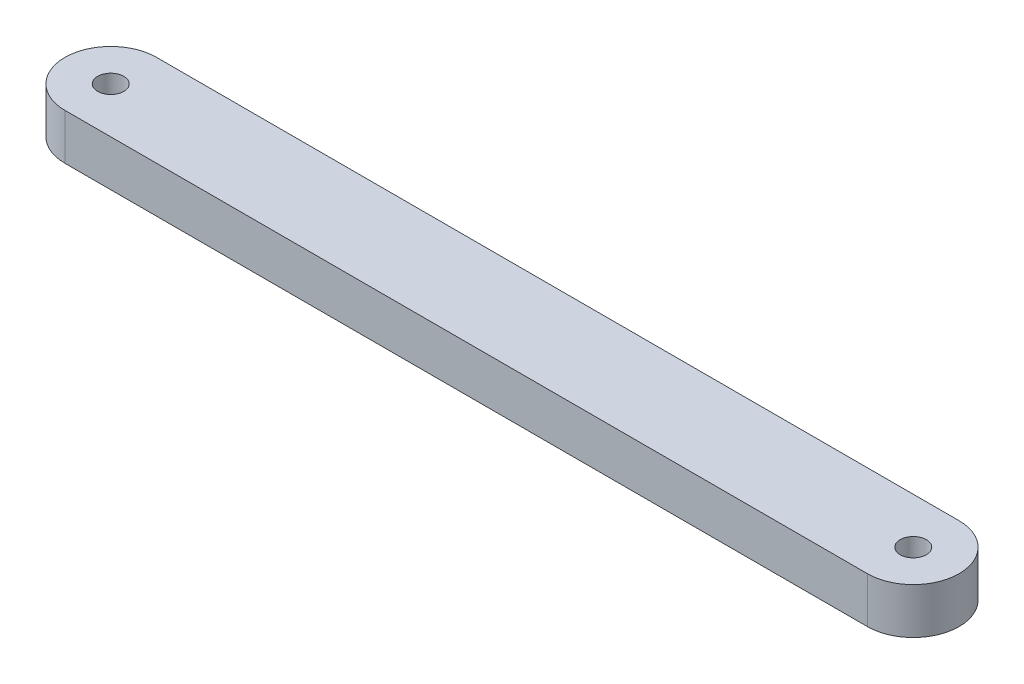
from build123d import *

# Parameters (mm, degrees)
SKETCH1_R           = 1.45
BOSS_EXTRUDE1_DEPTH = 5.08


with BuildPart() as part:
    # Sketch1 → Boss-Extrude1 (new body)
    with BuildSketch(Plane(origin=(0, 0, 0), x_dir=(1, 0, 0), z_dir=(0, 1, 0))):
        with BuildLine():
            Line((-44.45, 5.08), (44.45, 5.08))
            ThreePointArc((44.45, 5.08), (49.53, 0), (44.45, -5.08))
            Line((44.45, -5.08), (-44.45, -5.08))
            ThreePointArc((-44.45, -5.08), (-49.53, 0), (-44.45, 5.08))
        make_face()
        with Locations(Location((-44.45, 0, 0), (0, 0, 270))):
            Circle(SKETCH1_R, mode=Mode.SUBTRACT)
        with Locations(Location((44.45, 0, 0), (0, 0, 270))):
            Circle(SKETCH1_R, mode=Mode.SUBTRACT)
    extrude(amount=BOSS_EXTRUDE1_DEPTH)


solid = part.part
